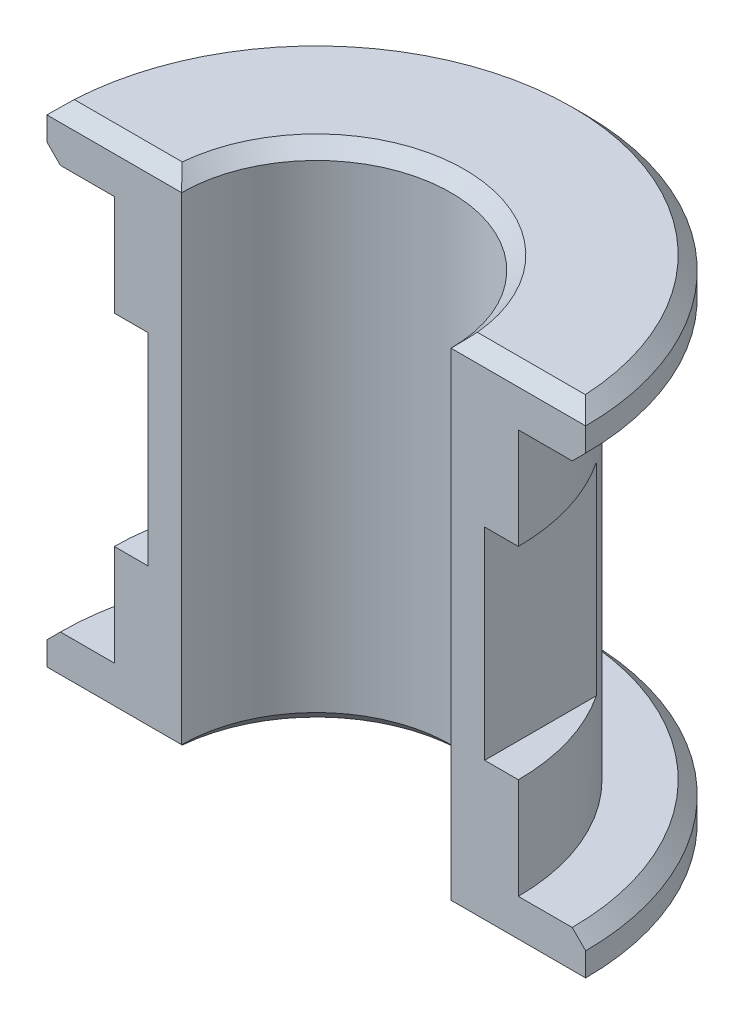
from build123d import *

# Parameters (mm, degrees)
REVOLVE_1_ANGLE     = 180
CUT_EXTRUDE_START   = -30
CUT_EXTRUDE_1_DEPTH = 30
CUT_EXTRUDE_2_DEPTH = 30
HOLE_WIZARD_M39_1_D = 40
CHAMFER_1_SIZE      = 2


with BuildPart() as part:
    # 草图1 → 旋转1 (revolve)
    with BuildSketch(Plane.XY):
        Polygon((0, 37.5), (0, -37.5), (40, -37.5), (40, -30), (30, -30), (30, 29.999999991), (40, 29.999999991), (40, 37.5), align=None)
    revolve(axis=Axis((0, 37.5, 0), (0, 1, 0)), revolution_arc=REVOLVE_1_ANGLE)

    # 草图2 → 切除-拉伸1 (cut)
    with BuildSketch(Plane.XZ.offset(15).offset(CUT_EXTRUDE_START)):
        with BuildLine():
            Line((25, 0), (25, -16.583123956))
            ThreePointArc((25, -16.583123956), (28.722813235, -8.66025404), (30.000000003, 0))
            Line((30.000000003, 0), (25, 0))
        make_face()
    extrude(amount=CUT_EXTRUDE_1_DEPTH, mode=Mode.SUBTRACT)

    # 草图3 → 切除-拉伸2 (cut)
    with BuildSketch(Plane.XZ.offset(15).offset(CUT_EXTRUDE_START)):
        with BuildLine():
            Line((-24.999999999, -16.583123954), (-24.999999999, 0))
            Line((-24.999999999, 0), (-30, 0))
            ThreePointArc((-30, 0), (-28.722813232, -8.660254039), (-24.999999999, -16.583123954))
        make_face()
    extrude(amount=CUT_EXTRUDE_2_DEPTH, mode=Mode.SUBTRACT)

    # M39 螺旋的螺纹孔钻头1 (through all)
    with Locations(Plane(origin=(0, 37.5, 0), x_dir=(1, 0, 0), z_dir=(0, 1, 0))):
        with Locations((0, 0)):
            Hole(HOLE_WIZARD_M39_1_D / 2)

    # 倒角1
    chamfer_1_edges = [part.edges().sort_by_distance(p)[0] for p in [
        (30, -37.5, 0),
        (0, 37.5, -40),
        (0, 29.999999991, -40),
        (0, -30, -40),
        (0, -37.5, -40),
        (-30, 37.5, 0),
        (-30, -37.5, 0),
        (30, 37.5, 0),
        (0, 37.5, -20),
        (0, -37.5, -20),
    ]]
    chamfer(chamfer_1_edges, length=CHAMFER_1_SIZE)


solid = part.part
